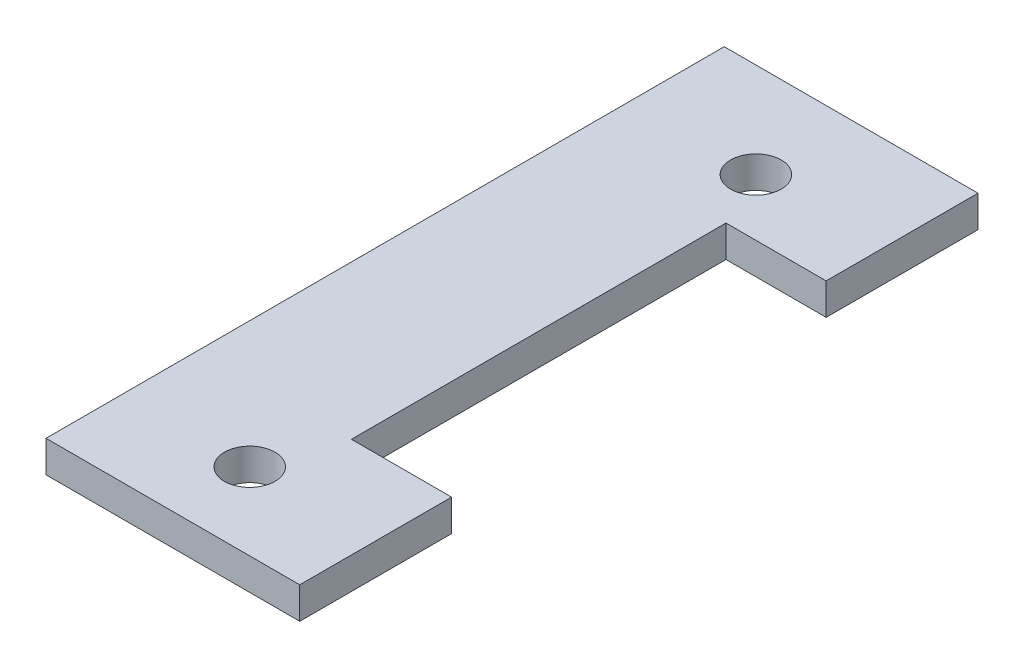
from build123d import *

# Parameters (mm, degrees)
BOSS_EXTRUDE3_DEPTH = 3.175
SKETCH13_R          = 2.54
CUT_EXTRUDE1_DEPTH  = 94.142393279


with BuildPart() as part:
    # Sketch1 → Boss-Extrude3 (new body)
    with BuildSketch(Plane(origin=(0, 0, 0), x_dir=(1, 0, 0), z_dir=(0, 1, 0))):
        Polygon((4.488713472, -20.064777789), (29.955520389, -20.064777789), (29.955520389, -35.304777789), (19.902942393, -35.304777789), (19.902942393, -72.896777789), (29.955520389, -72.896777789), (29.955520389, -88.136777789), (4.488713472, -88.136777789), align=None)
    extrude(amount=BOSS_EXTRUDE3_DEPTH)

    # Sketch13 → Cut-Extrude1 (cut, through all)
    with BuildSketch(Plane(origin=(0, 3.175, 0), x_dir=(1, 0, 0), z_dir=(0, 1, 0))):
        with Locations(Location((17.188713472, -29.589777789, 0), (0, 0, 270))):
            Circle(SKETCH13_R)
        with Locations(Location((17.188713472, -80.389777789, 0), (0, 0, 270))):
            Circle(SKETCH13_R)
    extrude(amount=-CUT_EXTRUDE1_DEPTH, mode=Mode.SUBTRACT)


solid = part.part
